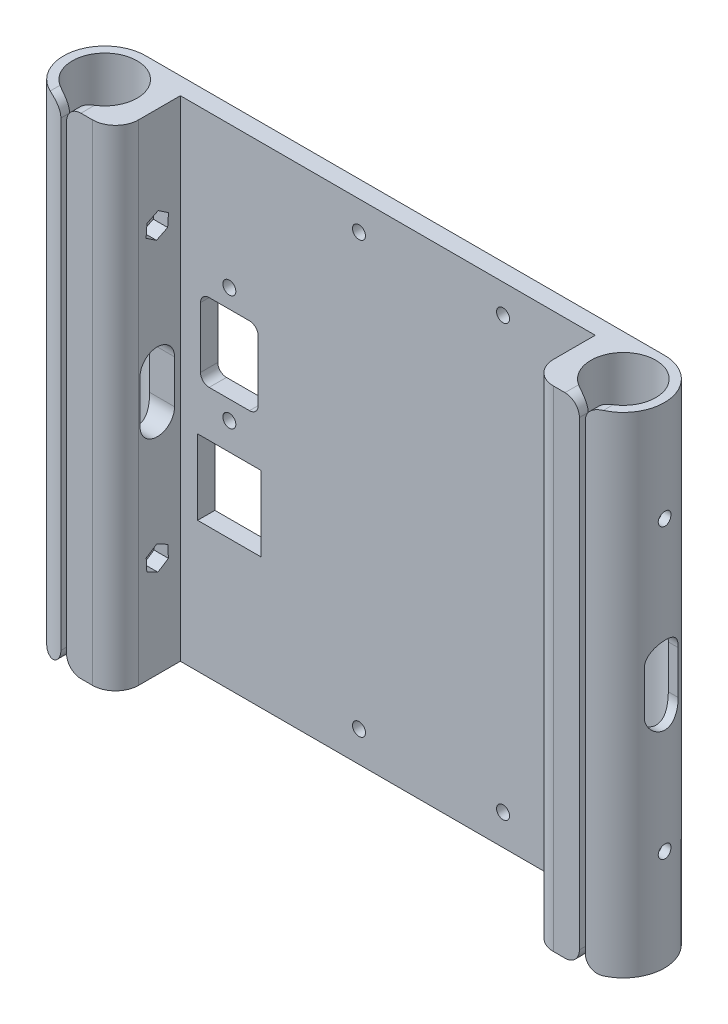
from build123d import *

# Parameters (mm, degrees)
SKETCH1_R               = 11.25
BOSS_EXTRUDE1_DEPTH     = 170
FILLET1_R               = 8
SKETCH2_R               = 2.25
CUT_EXTRUDE1_DEPTH      = 10
SKETCH3_R               = 2.25
SKETCH3_W               = 20
SKETCH3_H               = 27
CUT_EXTRUDE2_DEPTH      = 10
FILLET2_R               = 3
SKETCH4_W               = 22
SKETCH4_H               = 26
CUT_EXTRUDE3_DEPTH      = 10
SKETCH5_W               = 2
SKETCH5_H               = 170
CUT_EXTRUDE_THIN1_DEPTH = 10
FILLET3_R               = 5
CUT_EXTRUDE4_DEPTH      = 246.304530272
CUT_EXTRUDE4_DEPTH_BACK = 246.304530272
SKETCH7_R               = 2.25
CUT_EXTRUDE5_DEPTH      = 5
CUT_EXTRUDE6_DEPTH      = 3
SKETCH10_W              = 30
SKETCH10_H              = 128.101198444
SKETCH10_H_2            = 14
SKETCH10_W_2            = 15
SKETCH10_H_3            = 87.701029104
CUT_EXTRUDE7_DEPTH      = 2


with BuildPart() as part:
    # Sketch1 → Boss-Extrude1 (new body)
    with BuildSketch(Plane(origin=(0, 0, 0), x_dir=(1, 0, 0), z_dir=(0, 1, 0))):
        with BuildLine():
            Line((137.460581558, -14.5), (119.460581558, -14.5))
            Line((119.460581558, -14.5), (119.460581558, 8))
            Line((119.460581558, 8), (-24.539418442, 8))
            Line((-24.539418442, 8), (-24.539418442, -14.5))
            Line((-24.539418442, -14.5), (-42.539418442, -14.5))
            ThreePointArc((-42.539418442, -14.5), (-56.789418442, -0.25), (-42.539418442, 14))
            Line((-42.539418442, 14), (137.460581558, 14))
            ThreePointArc((137.460581558, 14), (151.710581558, -0.25), (137.460581558, -14.5))
        make_face()
        with Locations(Location((-42.539418442, -0.25, 0), (0, 0, 270))):
            Circle(SKETCH1_R, mode=Mode.SUBTRACT)
        with Locations(Location((137.460581558, -0.25, 0), (0, 0, 270))):
            Circle(SKETCH1_R, mode=Mode.SUBTRACT)
    extrude(amount=BOSS_EXTRUDE1_DEPTH)

    # Fillet1
    fillet1_edges = [part.edges().sort_by_distance(p)[0] for p in [
        (119.460581558, 85, 14.5),
        (-24.539418442, 85, 14.5),
    ]]
    fillet(fillet1_edges, radius=FILLET1_R)

    # Sketch2 → Cut-Extrude1 (cut)
    with BuildSketch(Plane.XY.offset(-8)):
        with Locations((87.460581558, 160)):
            Circle(SKETCH2_R)
        with Locations((37.460581558, 160)):
            Circle(SKETCH2_R)
        with Locations((37.460581558, 10.636264562)):
            Circle(SKETCH2_R)
        with Locations((87.460581558, 10.636264562)):
            Circle(SKETCH2_R)
    extrude(amount=-CUT_EXTRUDE1_DEPTH, mode=Mode.SUBTRACT)

    # Sketch3 → Cut-Extrude2 (cut)
    with BuildSketch(Plane.XY.offset(-8)):
        with Locations((-7.539418442, 80.824837088)):
            Circle(SKETCH3_R)
        with Locations((-7.539418442, 120.824837088)):
            Circle(SKETCH3_R)
        with Locations((-7.539418442, 100.824837088)):
            Rectangle(SKETCH3_W, SKETCH3_H)
    extrude(amount=-CUT_EXTRUDE2_DEPTH, mode=Mode.SUBTRACT)

    # Fillet2
    fillet2_edges = [part.edges().sort_by_distance(p)[0] for p in [
        (2.460581558, 114.324837088, -11),
        (2.460581558, 87.324837088, -11),
        (-17.539418442, 87.324837088, -11),
        (-17.539418442, 114.324837088, -11),
    ]]
    fillet(fillet2_edges, radius=FILLET2_R)

    # Sketch4 → Cut-Extrude3 (cut)
    with BuildSketch(Plane(origin=(0, 0, -14), x_dir=(-1, 0, 0), z_dir=(0, 0, -1))):
        with Locations((7.539418442, 58.365756838)):
            Rectangle(SKETCH4_W, SKETCH4_H)
    extrude(amount=-CUT_EXTRUDE3_DEPTH, mode=Mode.SUBTRACT)

    # Sketch5 → Cut-Extrude-Thin1 (cut)
    with BuildSketch(Plane.XY.offset(14.5)):
        with Locations((-42.539418442, 85)):
            Rectangle(SKETCH5_W, SKETCH5_H)
        with Locations((137.460581558, 85)):
            Rectangle(SKETCH5_W, SKETCH5_H)
    extrude(amount=-CUT_EXTRUDE_THIN1_DEPTH, mode=Mode.SUBTRACT)

    # Fillet3
    fillet3_edges = [part.edges().sort_by_distance(p)[0] for p in [
        (-43.539418442, 0, 12.960168196),
        (-43.539418442, 170, 12.960168196),
        (-41.539418442, 0, 12.977733708),
        (-41.539418442, 170, 12.977733708),
        (136.460581558, 170, 12.977733708),
        (138.460581558, 170, 12.960168196),
        (138.460581558, 0, 12.960168196),
        (136.460581558, 0, 12.977733708),
    ]]
    fillet(fillet3_edges, radius=FILLET3_R)

    # Sketch7 → Cut-Extrude4 (cut, two sides: drawn at the far end of the back side and taken through both)
    with BuildSketch(Plane(origin=(-24.539418442, 0, 0), x_dir=(0, 0, -1), z_dir=(1, 0, 0)).offset(-CUT_EXTRUDE4_DEPTH_BACK)):
        with Locations((0, 135)):
            Circle(SKETCH7_R)
        with Locations((0, 35)):
            Circle(SKETCH7_R)
        with BuildLine():
            Line((6, 92.5), (6, 77.5))
            ThreePointArc((6, 77.5), (0, 71.5), (-6, 77.5))
            Line((-6, 77.5), (-6, 92.5))
            ThreePointArc((-6, 92.5), (0, 98.5), (6, 92.5))
        make_face()
    extrude(amount=CUT_EXTRUDE4_DEPTH + CUT_EXTRUDE4_DEPTH_BACK, mode=Mode.SUBTRACT)

    # Sketch8 → Cut-Extrude5 (cut)
    with BuildSketch(Plane(origin=(-24.539418442, 0, 0), x_dir=(0, 0, -1), z_dir=(1, 0, 0))):
        Polygon((-0.28928718, 130.679547139), (3.596978344, 132.589243523), (3.886265524, 136.909696384), (0.28928718, 139.320452861), (-3.596978344, 137.410756477), (-3.886265524, 133.090303616), align=None)
        Polygon((-0.208033794, 39.325126812), (-3.849686591, 36.982400855), (-3.641652797, 32.657274043), (0.208033794, 30.674873188), (3.849686591, 33.017599145), (3.641652797, 37.342725957), align=None)
    cut_extrude5 = extrude(amount=-CUT_EXTRUDE5_DEPTH, mode=Mode.SUBTRACT)

    # Mirror1: Cut-Extrude5 across plane
    add(cut_extrude5.mirror(Plane(origin=(47.460581558, 0, 0), x_dir=(0, 0, 1), z_dir=(1, 0, 0))), mode=Mode.SUBTRACT)

    # Sketch9 → Cut-Extrude6 (cut)
    with BuildSketch(Plane(origin=(0, 0, -14), x_dir=(-1, 0, 0), z_dir=(0, 0, -1))):
        with BuildLine():
            Line((7.539418442, 15), (-102.460581558, 15))
            ThreePointArc((-102.460581558, 15), (-109.53164937, 17.928932188), (-112.460581558, 25))
            Line((-112.460581558, 25), (-112.460581558, 145))
            ThreePointArc((-112.460581558, 145), (-109.53164937, 152.071067812), (-102.460581558, 155))
            Line((-102.460581558, 155), (7.539418442, 155))
            ThreePointArc((7.539418442, 155), (14.610486254, 152.071067812), (17.539418442, 145))
            Line((17.539418442, 145), (17.539418442, 140))
            ThreePointArc((17.539418442, 140), (14.610486254, 132.928932188), (7.539418442, 130))
            Line((7.539418442, 130), (-2.460581558, 130))
            ThreePointArc((-2.460581558, 130), (-9.53164937, 127.071067812), (-12.460581558, 120))
            Line((-12.460581558, 120), (-12.460581558, 50))
            ThreePointArc((-12.460581558, 50), (-9.53164937, 42.928932188), (-2.460581558, 40))
            Line((-2.460581558, 40), (7.539418442, 40))
            ThreePointArc((7.539418442, 40), (14.610486254, 37.071067812), (17.539418442, 30))
            Line((17.539418442, 30), (17.539418442, 25))
            ThreePointArc((17.539418442, 25), (14.610486254, 17.928932188), (7.539418442, 15))
        make_face()
    extrude(amount=-CUT_EXTRUDE6_DEPTH, mode=Mode.SUBTRACT)

    # Sketch10 → Cut-Extrude7 (cut)
    with BuildSketch(Plane(origin=(0, 0, -11), x_dir=(-1, 0, 0), z_dir=(0, 0, -1))):
        with Locations((-89.764591577, 84.566229749)):
            Rectangle(SKETCH10_W, SKETCH10_H)
        with Locations((-53.82187813, 84.566229749)):
            Rectangle(SKETCH10_W, SKETCH10_H)
        with Locations((-18.822925977, 27.515630527)):
            Rectangle(SKETCH10_W, SKETCH10_H_2)
        with Locations((-18.822925977, 142.800227591)):
            Rectangle(SKETCH10_W, SKETCH10_H_2)
        with Locations((-26.322925977, 86.239516609)):
            Rectangle(SKETCH10_W_2, SKETCH10_H_3)
    extrude(amount=-CUT_EXTRUDE7_DEPTH, mode=Mode.SUBTRACT)


solid = part.part
